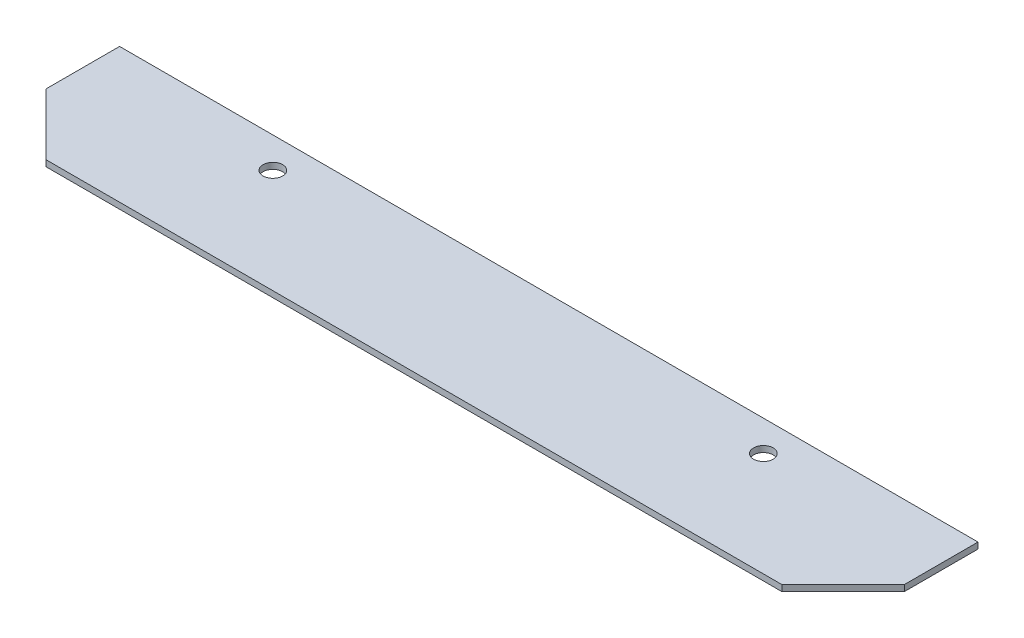
from build123d import *

# Parameters (mm, degrees)
SKETCH_1_W          = 140
SKETCH_1_H          = 22
EXTRUDE_1_DEPTH     = 1
SKETCH_2_R          = 1.6
CUT_EXTRUDE_1_DEPTH = 10
CHAMFER_1_SIZE      = 10


with BuildPart() as part:
    # 草图1 → 凸台-拉伸1 (new body)
    with BuildSketch(Plane(origin=(0, 0, 0), x_dir=(1, 0, 0), z_dir=(0, 1, 0))):
        Rectangle(SKETCH_1_W, SKETCH_1_H)
    extrude(amount=EXTRUDE_1_DEPTH)

    # 草图2 → 切除-拉伸1 (cut)
    with BuildSketch(Plane.XZ):
        with Locations(Location((40, -6, 0), (0, 0, 270))):
            Circle(SKETCH_2_R)
        with Locations(Location((-40, -6, 0), (0, 0, 270))):
            Circle(SKETCH_2_R)
    extrude(amount=-CUT_EXTRUDE_1_DEPTH, mode=Mode.SUBTRACT)

    # 倒角1
    chamfer_1_edges = [part.edges().sort_by_distance(p)[0] for p in [
        (70, 0.5, 11),
        (-70, 0.5, 11),
    ]]
    chamfer(chamfer_1_edges, length=CHAMFER_1_SIZE)


solid = part.part
